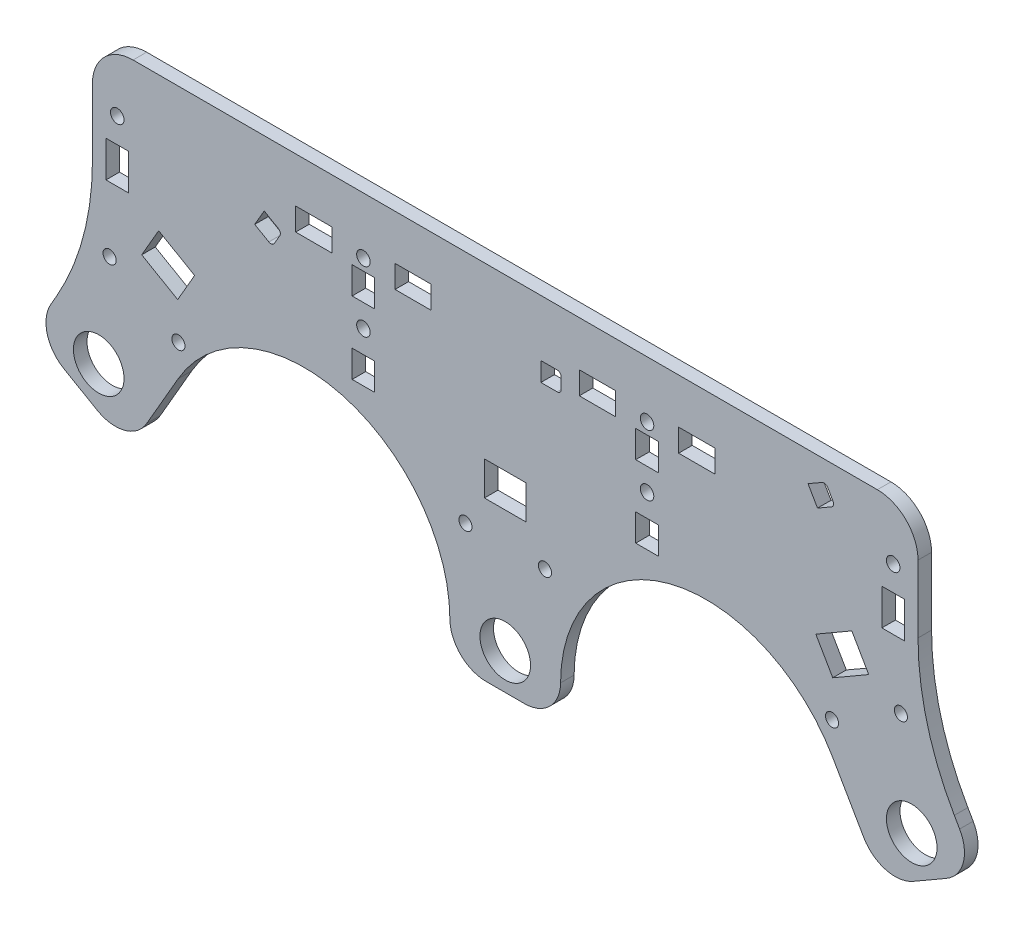
from build123d import *

# Parameters (mm, degrees)
BOSS_EXTRUDE1_DEPTH = 3
FILLET1_R           = 60
FILLET2_R           = 8
SKETCH3_R           = 1.45
SKETCH3_R_2         = 5.6
SKETCH3_W           = 9.2
SKETCH3_H           = 7.5
CUT_EXTRUDE1_DEPTH  = 125.676613305
SKETCH4_R           = 1.5
SKETCH4_W           = 8
SKETCH4_H           = 5
CUT_EXTRUDE2_DEPTH  = 125.676613305
SKETCH5_W           = 5
SKETCH5_H           = 8
CUT_EXTRUDE3_DEPTH  = 125.676613305
FILLET3_R           = 9
SKETCH6_R           = 1.5
SKETCH6_W           = 5
SKETCH6_H           = 6
CUT_EXTRUDE4_DEPTH  = 125.676613305


with BuildPart() as part:
    # Sketch1 → Boss-Extrude1 (new body)
    with BuildSketch(Plane.XY):
        Polygon((-83.391188804, -3.05320323), (-63.103878976, 32.08544814), (-12.25, 32.08544814), (-12.25, -8), (12.25, -8), (12.25, 32.08544814), (63.103878976, 32.08544814), (83.391188804, -3.05320323), (104.608811196, 9.19679677), (91.394042166, 32.08544814), (91.394042166, 72.08544814), (-91.394042166, 72.08544814), (-91.394042166, 32.08544814), (-104.608811196, 9.19679677), align=None)
        with BuildLine():
            ThreePointArc((-72.410784769, 15.965414445), (-60.610101085, 27.766098129), (-44.49006739, 32.08544814))
            Line((-44.49006739, 32.08544814), (-63.103878976, 32.08544814))
            Line((-63.103878976, 32.08544814), (-72.410784769, 15.965414445))
        make_face()
        with BuildLine():
            Line((-12.25, -0.15461925), (-12.25, 32.08544814))
            Line((-12.25, 32.08544814), (-44.49006739, 32.08544814))
            ThreePointArc((-44.49006739, 32.08544814), (-21.692897113, 22.642551027), (-12.25, -0.15461925))
        make_face()
        with BuildLine():
            Line((12.25, 32.08544814), (12.25, -0.15461925))
            ThreePointArc((12.25, -0.15461925), (21.692897113, 22.642551027), (44.49006739, 32.08544814))
            Line((44.49006739, 32.08544814), (12.25, 32.08544814))
        make_face()
        with BuildLine():
            Line((63.103878976, 32.08544814), (44.49006739, 32.08544814))
            ThreePointArc((44.49006739, 32.08544814), (60.610101085, 27.766098129), (72.410784769, 15.965414445))
            Line((72.410784769, 15.965414445), (63.103878976, 32.08544814))
        make_face()
    extrude(amount=BOSS_EXTRUDE1_DEPTH)

    # Fillet1
    fillet1_edges = [part.edges().sort_by_distance(p)[0] for p in [
        (-91.394042166, 32.08544814, 1.5),
        (91.394042166, 32.08544814, 1.5),
    ]]
    fillet(fillet1_edges, radius=FILLET1_R)

    # Fillet2
    fillet2_edges = [part.edges().sort_by_distance(p)[0] for p in [
        (-104.608811196, 9.19679677, 1.5),
        (-83.391188804, -3.05320323, 1.5),
        (-12.25, -8, 1.5),
        (12.25, -8, 1.5),
        (83.391188804, -3.05320323, 1.5),
        (104.608811196, 9.19679677, 1.5),
    ]]
    fillet(fillet2_edges, radius=FILLET2_R)

    # Sketch3 → Cut-Extrude1 (cut, through all)
    with BuildSketch(Plane.XY.offset(3)):
        with Locations((87.596023553, 31.763809346)):
            Circle(SKETCH3_R)
        with Locations((72.353976447, 22.963809346)):
            Circle(SKETCH3_R)
        with Locations((8.8, 20.05)):
            Circle(SKETCH3_R)
        with Locations((-8.8, 20.05)):
            Circle(SKETCH3_R)
        with Locations((-87.596023553, 31.763809346)):
            Circle(SKETCH3_R)
        with Locations((-72.353976447, 22.963809346)):
            Circle(SKETCH3_R)
        Circle(SKETCH3_R_2)
        with Locations((-90, 10)):
            Circle(SKETCH3_R_2)
        with Locations((90, 10)):
            Circle(SKETCH3_R_2)
        with BuildLine():
            Line((-53.35839931, 57.665114066), (-55.45839931, 54.02780737))
            Line((-55.45839931, 54.02780737), (-52.340707856, 52.22780737))
            ThreePointArc((-52.340707856, 52.22780737), (-51.657770716, 52.137896989), (-51.111284993, 52.557230233))
            Line((-51.111284993, 52.557230233), (-49.911284993, 54.635691202))
            ThreePointArc((-49.911284993, 54.635691202), (-49.821374613, 55.318628343), (-50.240707856, 55.865114066))
            Line((-50.240707856, 55.865114066), (-53.35839931, 57.665114066))
        make_face()
        with BuildLine():
            Line((7.9, 59.6), (7.9, 55.4))
            Line((7.9, 55.4), (11.5, 55.4))
            ThreePointArc((11.5, 55.4), (12.136396103, 55.663603897), (12.4, 56.3))
            Line((12.4, 56.3), (12.4, 58.7))
            ThreePointArc((12.4, 58.7), (12.136396103, 59.336396103), (11.5, 59.6))
            Line((11.5, 59.6), (7.9, 59.6))
        make_face()
        with BuildLine():
            Line((67.04160069, 65.565114066), (69.14160069, 61.92780737))
            Line((69.14160069, 61.92780737), (72.259292144, 63.72780737))
            ThreePointArc((72.259292144, 63.72780737), (72.678625387, 64.274293092), (72.588715007, 64.957230233))
            Line((72.588715007, 64.957230233), (71.388715007, 67.035691202))
            ThreePointArc((71.388715007, 67.035691202), (70.842229284, 67.455024446), (70.159292144, 67.365114066))
            Line((70.159292144, 67.365114066), (67.04160069, 65.565114066))
        make_face()
        Polygon((-68.766283143, 37.577876431), (-76.733716857, 42.177876431), (-80.483716857, 35.682685902), (-72.516283143, 31.082685902), align=None)
        with Locations((0, 30.75)):
            Rectangle(SKETCH3_W, SKETCH3_H)
        Polygon((76.733716857, 42.177876431), (68.766283143, 37.577876431), (72.516283143, 31.082685902), (80.483716857, 35.682685902), align=None)
    extrude(amount=-CUT_EXTRUDE1_DEPTH, mode=Mode.SUBTRACT)

    # Sketch4 → Cut-Extrude2 (cut, through all)
    with BuildSketch(Plane.XY.offset(3)):
        with Locations((-31.394042166, 59.58544814)):
            Circle(SKETCH4_R)
        with Locations((31.394042166, 59.58544814)):
            Circle(SKETCH4_R)
        with Locations((-85.894042166, 59.58544814)):
            Circle(SKETCH4_R)
        with Locations((85.894042166, 59.58544814)):
            Circle(SKETCH4_R)
        with Locations((-42.394042166, 59.58544814)):
            Rectangle(SKETCH4_W, SKETCH4_H)
        with Locations((-20.394042166, 59.58544814)):
            Rectangle(SKETCH4_W, SKETCH4_H)
        with Locations((20.394042166, 59.58544814)):
            Rectangle(SKETCH4_W, SKETCH4_H)
        with Locations((42.394042166, 59.58544814)):
            Rectangle(SKETCH4_W, SKETCH4_H)
    extrude(amount=-CUT_EXTRUDE2_DEPTH, mode=Mode.SUBTRACT)

    # Sketch5 → Cut-Extrude3 (cut, through all)
    with BuildSketch(Plane.XY.offset(3)):
        with Locations((-85.894042166, 50.08544814)):
            Rectangle(SKETCH5_W, SKETCH5_H)
        with Locations((85.894042166, 50.08544814)):
            Rectangle(SKETCH5_W, SKETCH5_H)
    extrude(amount=-CUT_EXTRUDE3_DEPTH, mode=Mode.SUBTRACT)

    # Fillet3
    fillet3_edges = [part.edges().sort_by_distance(p)[0] for p in [
        (-91.394042166, 72.08544814, 1.5),
        (91.394042166, 72.08544814, 1.5),
    ]]
    fillet(fillet3_edges, radius=FILLET3_R)

    # Sketch6 → Cut-Extrude4 (cut, through all)
    with BuildSketch(Plane.XY.offset(3)):
        with Locations((-31.394042166, 46.08544814)):
            Circle(SKETCH6_R)
        with Locations((31.394042166, 46.08544814)):
            Circle(SKETCH6_R)
        with Locations((31.394042166, 38.08544814)):
            Rectangle(SKETCH6_W, SKETCH6_H)
        with Locations((31.394042166, 54.08544814)):
            Rectangle(SKETCH6_W, SKETCH6_H)
        with Locations((-31.394042166, 54.08544814)):
            Rectangle(SKETCH6_W, SKETCH6_H)
        with Locations((-31.394042166, 38.08544814)):
            Rectangle(SKETCH6_W, SKETCH6_H)
    extrude(amount=-CUT_EXTRUDE4_DEPTH, mode=Mode.SUBTRACT)


solid = part.part
